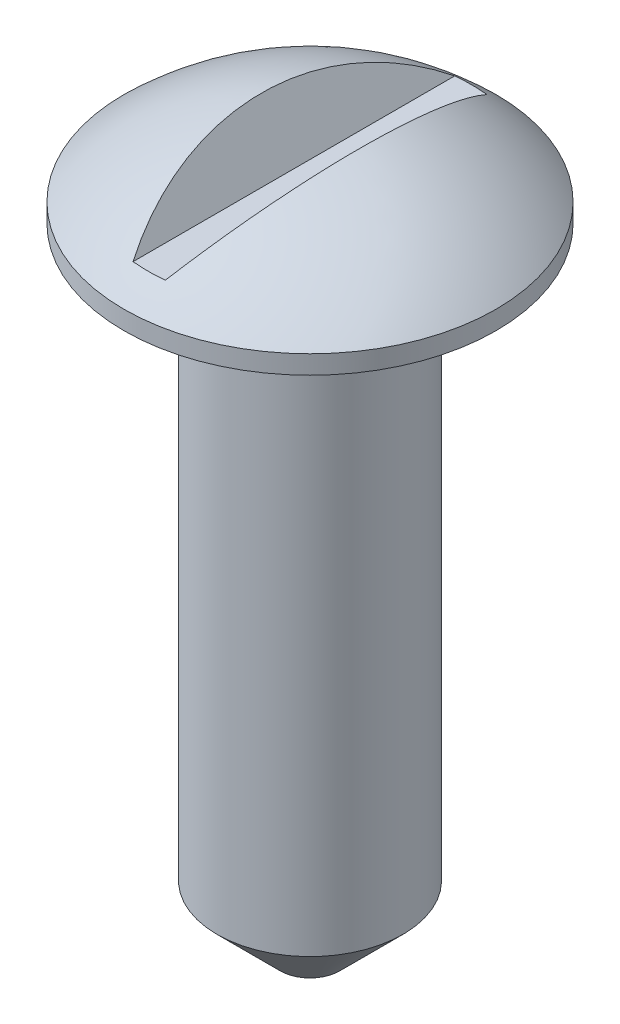
from build123d import *

# Parameters (mm, degrees)
DOME1_FACE_RADIUS       = 500
DOME1_HEIGHT            = 200
CUT_EXTRUDE1_DEPTH      = 2075.246851269
CUT_EXTRUDE1_DEPTH_BACK = 2075.246851269
CHAMFER5_SIZE           = 170


with BuildPart() as part:
    # Sketch1 → Revolve1 (revolve)
    with BuildSketch(Plane.XY, mode=Mode.PRIVATE) as revolve1_sk:
        Polygon((0, 0), (-250, 0), (-250, 1700), (-500, 1700), (-500, 1750), (0, 1750), align=None)
    revolve(revolve1_sk.sketch.rotate(Axis((0, 0, 0), (0, -1, 0)), 270), axis=Axis((0, 0, 0), (0, -1, 0)))

    # Dome1: a dome of height H over a round flat face of radius A is a cap of a sphere of radius (A * A + H * H) / (2 * H)
    dome1_r = (DOME1_FACE_RADIUS * DOME1_FACE_RADIUS + DOME1_HEIGHT * DOME1_HEIGHT) / (2 * DOME1_HEIGHT)
    dome1_base = Plane((0, 1750, 0), z_dir=(0, 1, 0))
    with Locations(dome1_base.offset(DOME1_HEIGHT - dome1_r)):
        dome1_ball = Sphere(dome1_r, mode=Mode.PRIVATE)
    add(split(dome1_ball, bisect_by=dome1_base, keep=Keep.TOP, mode=Mode.PRIVATE))

    # Sketch2 → Cut-Extrude1 (cut, two sides: drawn at the far end of the back side and taken through both)
    with BuildSketch(Plane.XY.offset(-CUT_EXTRUDE1_DEPTH_BACK)):
        Polygon((-2374.803234017, 5352.955339177), (-130.529221516, 1938.152944557), (-43.296369992, 1805.422739327), (43.296369992, 1805.422739327), (130.529221516, 1938.152944557), (2374.803234017, 5352.955339177), (2374.803234017, 13525.50481593), (-2374.803234017, 13525.50481593), align=None)
    extrude(amount=CUT_EXTRUDE1_DEPTH + CUT_EXTRUDE1_DEPTH_BACK, mode=Mode.SUBTRACT)

    # Chamfer5
    chamfer5_edges = [part.edges().sort_by_distance(p)[0] for p in [
        (0, 0, -250),
    ]]
    chamfer(chamfer5_edges, length=CHAMFER5_SIZE)


solid = part.part
